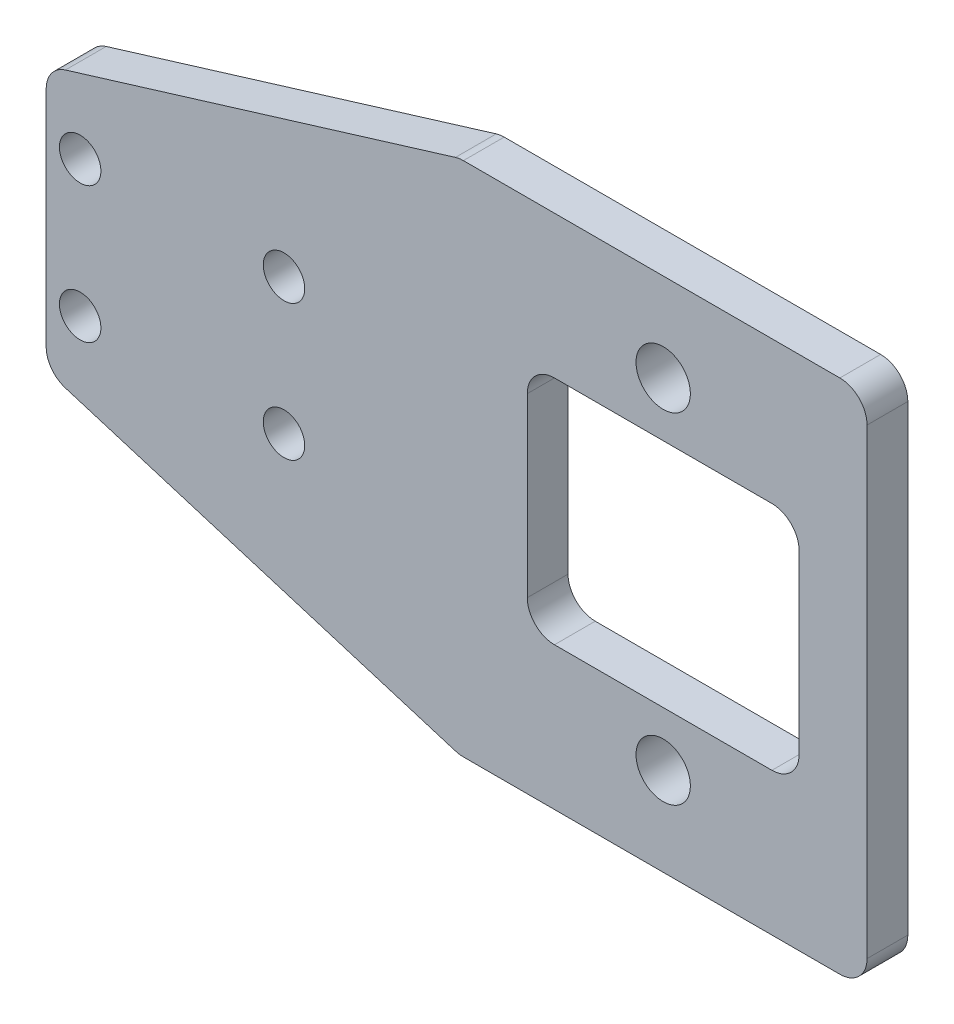
from build123d import *

# Parameters (mm, degrees)
SKETCH_1_W          = 30
SKETCH_1_H          = 38
EXTRUDE_1_DEPTH     = 3
SKETCH_2_R          = 2
CUT_EXTRUDE_1_DEPTH = 3
SKETCH_3_R          = 1.525
CUT_EXTRUDE_2_DEPTH = 3
FILLET_1_R          = 2
SKETCH_4_W          = 20
SKETCH_4_H          = 17
CUT_EXTRUDE_3_DEPTH = 3
FILLET_2_R          = 2


with BuildPart() as part:
    # 草图1 → 凸台-拉伸1 (new body)
    with BuildSketch(Plane.XY):
        Polygon((-45.4, 9.7), (-45.4, -9.7), (-15, -19), (-15, 19), align=None)
        Rectangle(SKETCH_1_W, SKETCH_1_H)
    extrude(amount=EXTRUDE_1_DEPTH)

    # 草图2 → 切除-拉伸1 (cut)
    with BuildSketch(Plane.XY.offset(3)):
        with Locations((0, 12.5)):
            Circle(SKETCH_2_R)
        with Locations((0, -12.5)):
            Circle(SKETCH_2_R)
    extrude(amount=-CUT_EXTRUDE_1_DEPTH, mode=Mode.SUBTRACT)

    # 草图3 → 切除-拉伸2 (cut)
    with BuildSketch(Plane.XY.offset(3)):
        with Locations((-42.9, 5)):
            Circle(SKETCH_3_R)
        with Locations((-27.9, 5)):
            Circle(SKETCH_3_R)
        with Locations((-42.9, -5)):
            Circle(SKETCH_3_R)
        with Locations((-27.9, -5)):
            Circle(SKETCH_3_R)
    extrude(amount=-CUT_EXTRUDE_2_DEPTH, mode=Mode.SUBTRACT)

    # 圆角1
    fillet_1_edges = [part.edges().sort_by_distance(p)[0] for p in [
        (-45.4, 9.7, 1.5),
        (-15, 19, 1.5),
        (15, 19, 1.5),
        (15, -19, 1.5),
        (-15, -19, 1.5),
        (-45.4, -9.7, 1.5),
    ]]
    fillet(fillet_1_edges, radius=FILLET_1_R)

    # 草图4 → 切除-拉伸3 (cut)
    with BuildSketch(Plane.XY.offset(3)):
        Rectangle(SKETCH_4_W, SKETCH_4_H)
    extrude(amount=-CUT_EXTRUDE_3_DEPTH, mode=Mode.SUBTRACT)

    # 圆角2
    fillet_2_edges = [part.edges().sort_by_distance(p)[0] for p in [
        (10, 8.5, 1.5),
        (10, -8.5, 1.5),
        (-10, -8.5, 1.5),
        (-10, 8.5, 1.5),
    ]]
    fillet(fillet_2_edges, radius=FILLET_2_R)


solid = part.part
